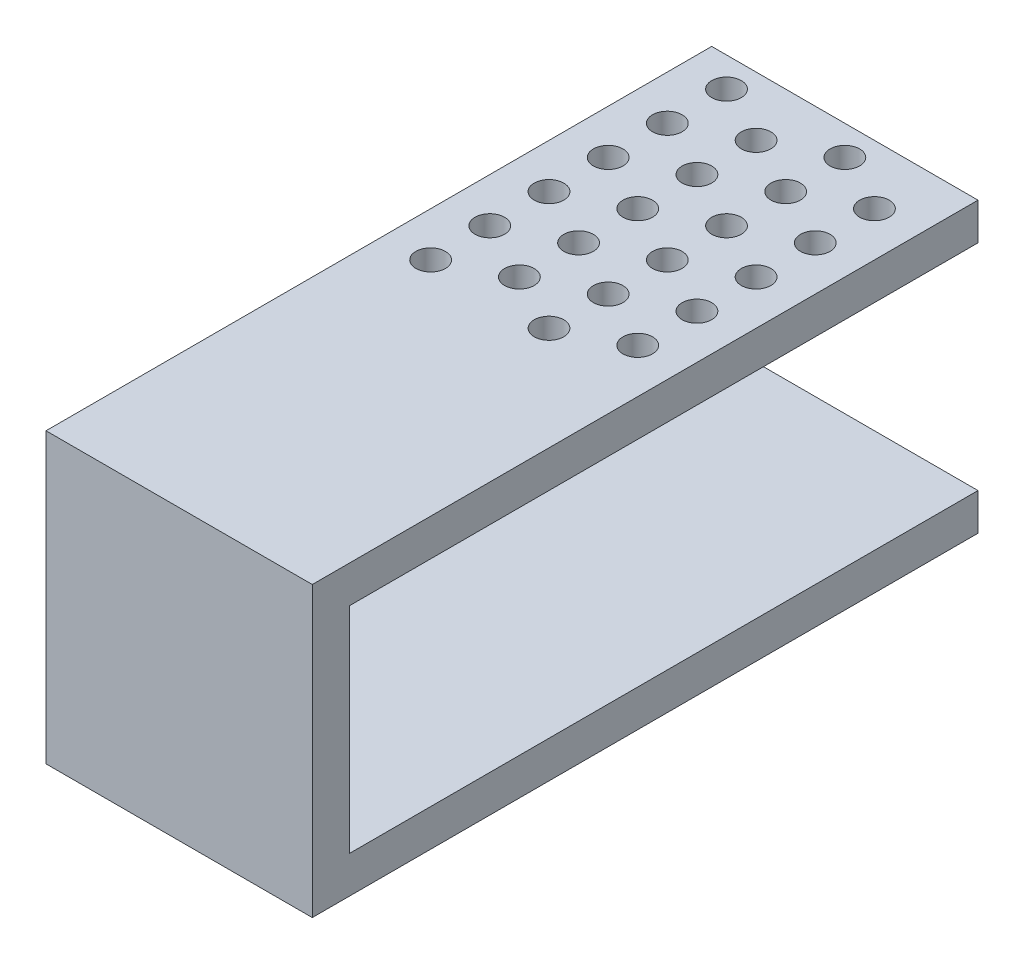
from build123d import *

# Parameters (mm, degrees)
SKETCH2_W           = 18
SKETCH2_H           = 24
SKETCH2_R           = 1
BOSS_EXTRUDE2_DEPTH = 2.5
SKETCH3_W           = 18
SKETCH3_H           = 2.5
BOSS_EXTRUDE3_DEPTH = 21
SKETCH4_W           = 18
SKETCH4_H           = 2.5
BOSS_EXTRUDE4_DEPTH = 17
SKETCH5_W           = 18
SKETCH5_H           = 2.5
BOSS_EXTRUDE5_DEPTH = 42.5


with BuildPart() as part:
    # Sketch2 → Boss-Extrude2 (new body)
    with BuildSketch(Plane(origin=(0, 0, 0), x_dir=(1, 0, 0), z_dir=(0, 1, 0))):
        with Locations((-11, 4)):
            Rectangle(SKETCH2_W, SKETCH2_H)
        with Locations(Location((-17, -6, 0), (0, 0, 270))):
            Circle(SKETCH2_R, mode=Mode.SUBTRACT)
        with Locations(Location((-17, -2, 0), (0, 0, 270))):
            Circle(SKETCH2_R, mode=Mode.SUBTRACT)
        with Locations(Location((-17, 2, 0), (0, 0, 270))):
            Circle(SKETCH2_R, mode=Mode.SUBTRACT)
        with Locations(Location((-17, 6, 0), (0, 0, 270))):
            Circle(SKETCH2_R, mode=Mode.SUBTRACT)
        with Locations(Location((-17, 10, 0), (0, 0, 270))):
            Circle(SKETCH2_R, mode=Mode.SUBTRACT)
        with Locations(Location((-17, 14, 0), (0, 0, 270))):
            Circle(SKETCH2_R, mode=Mode.SUBTRACT)
        with Locations(Location((-13, -4, 0), (0, 0, 270))):
            Circle(SKETCH2_R, mode=Mode.SUBTRACT)
        with Locations(Location((-13, 0, 0), (0, 0, 270))):
            Circle(SKETCH2_R, mode=Mode.SUBTRACT)
        with Locations(Location((-13, 4, 0), (0, 0, 270))):
            Circle(SKETCH2_R, mode=Mode.SUBTRACT)
        with Locations(Location((-13, 8, 0), (0, 0, 270))):
            Circle(SKETCH2_R, mode=Mode.SUBTRACT)
        with Locations(Location((-13, 12, 0), (0, 0, 270))):
            Circle(SKETCH2_R, mode=Mode.SUBTRACT)
        with Locations(Location((-9, -6, 0), (0, 0, 270))):
            Circle(SKETCH2_R, mode=Mode.SUBTRACT)
        with Locations(Location((-9, -2, 0), (0, 0, 270))):
            Circle(SKETCH2_R, mode=Mode.SUBTRACT)
        with Locations(Location((-9, 2, 0), (0, 0, 270))):
            Circle(SKETCH2_R, mode=Mode.SUBTRACT)
        with Locations(Location((-9, 6, 0), (0, 0, 270))):
            Circle(SKETCH2_R, mode=Mode.SUBTRACT)
        with Locations(Location((-9, 10, 0), (0, 0, 270))):
            Circle(SKETCH2_R, mode=Mode.SUBTRACT)
        with Locations(Location((-9, 14, 0), (0, 0, 270))):
            Circle(SKETCH2_R, mode=Mode.SUBTRACT)
        with Locations(Location((-5, -4, 0), (0, 0, 270))):
            Circle(SKETCH2_R, mode=Mode.SUBTRACT)
        with Locations(Location((-5, 0, 0), (0, 0, 270))):
            Circle(SKETCH2_R, mode=Mode.SUBTRACT)
        with Locations(Location((-5, 4, 0), (0, 0, 270))):
            Circle(SKETCH2_R, mode=Mode.SUBTRACT)
        with Locations(Location((-5, 8, 0), (0, 0, 270))):
            Circle(SKETCH2_R, mode=Mode.SUBTRACT)
        with Locations(Location((-5, 12, 0), (0, 0, 270))):
            Circle(SKETCH2_R, mode=Mode.SUBTRACT)
    extrude(amount=BOSS_EXTRUDE2_DEPTH)

    # Sketch3 → Boss-Extrude3 (add)
    with BuildSketch(Plane.XY.offset(8)):
        with Locations((-11, 1.25)):
            Rectangle(SKETCH3_W, SKETCH3_H)
    extrude(amount=BOSS_EXTRUDE3_DEPTH)

    # Sketch4 → Boss-Extrude4 (add)
    with BuildSketch(Plane(origin=(0, 0, 0), x_dir=(-1, 0, 0), z_dir=(0, -1, 0))):
        with Locations((11, -27.75)):
            Rectangle(SKETCH4_W, SKETCH4_H)
    extrude(amount=BOSS_EXTRUDE4_DEPTH)

    # Sketch5 → Boss-Extrude5 (add)
    with BuildSketch(Plane(origin=(0, 0, 26.5), x_dir=(-1, 0, 0), z_dir=(0, 0, -1))):
        with Locations((11, -15.75)):
            Rectangle(SKETCH5_W, SKETCH5_H)
    extrude(amount=BOSS_EXTRUDE5_DEPTH)


solid = part.part
